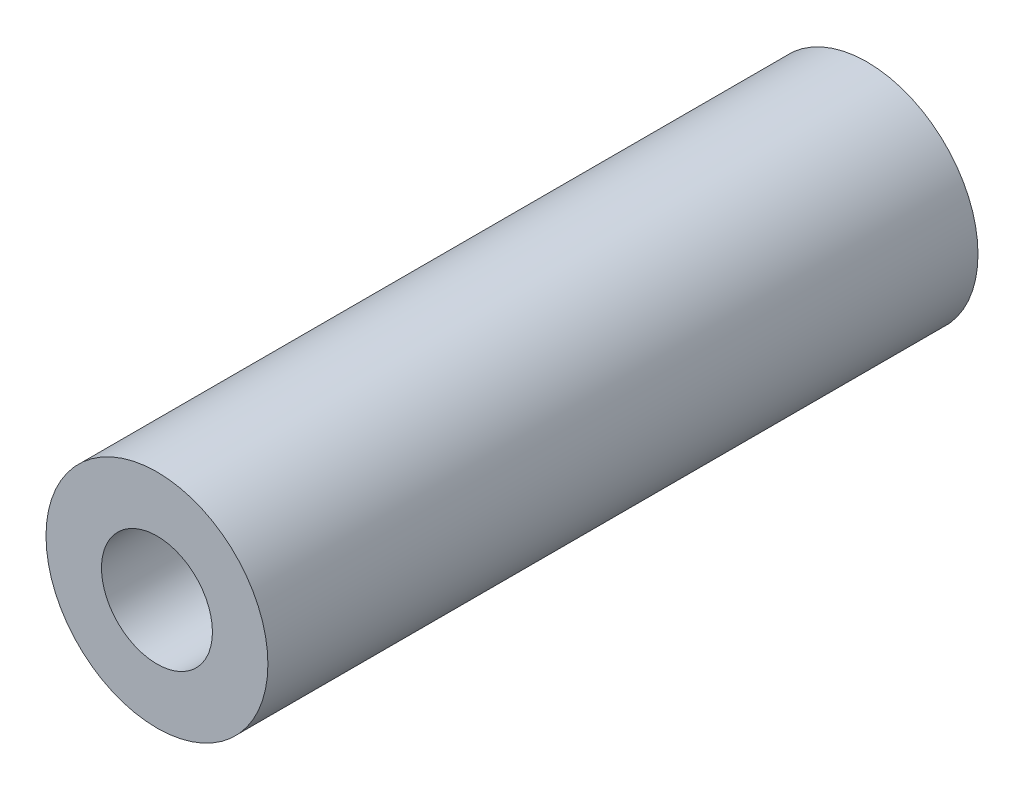
from build123d import *

# Parameters (mm, degrees)
SKETCH2_R           = 2.5
SKETCH2_R_2         = 1.25
BOSS_EXTRUDE1_DEPTH = 16


with BuildPart() as part:
    # Sketch2 → Boss-Extrude1 (new body)
    with BuildSketch(Plane.XY):
        Circle(SKETCH2_R)
        Circle(SKETCH2_R_2, mode=Mode.SUBTRACT)
    extrude(amount=-BOSS_EXTRUDE1_DEPTH)


solid = part.part
